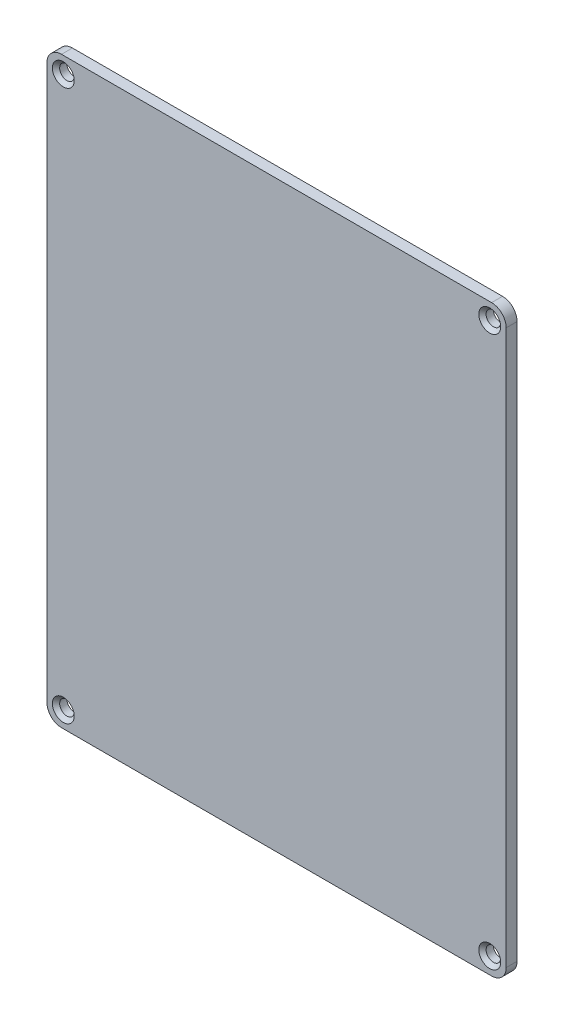
from build123d import *

# Parameters (mm, degrees)
IZIM1_W                     = 63
IZIM1_H                     = 80
Y_KSEKLIK_EKSTR_ZYON1_DEPTH = 1.5
IZIM2_R                     = 1
KES_EKSTR_ZYON1_DEPTH       = 1.5
RADYUS1_R                   = 2
PAH1_SIZE                   = 0.5


with BuildPart() as part:
    # Çizim1 → Yükseklik-Ekstrüzyon1 (new body)
    with BuildSketch(Plane.XY):
        Rectangle(IZIM1_W, IZIM1_H)
    extrude(amount=Y_KSEKLIK_EKSTR_ZYON1_DEPTH)

    # Çizim2 → Kes-Ekstrüzyon1 (cut)
    with BuildSketch(Plane.XY.offset(1.5)):
        with Locations((-29.25, 37.75)):
            Circle(IZIM2_R)
        with Locations(Location((29.25, 37.75, 0), (0, 0, 180))):
            Circle(IZIM2_R)
        with Locations((29.25, -37.75)):
            Circle(IZIM2_R)
        with Locations(Location((-29.25, -37.75, 0), (0, 0, 180))):
            Circle(IZIM2_R)
    extrude(amount=-KES_EKSTR_ZYON1_DEPTH, mode=Mode.SUBTRACT)

    # Radyus1
    radyus1_edges = [part.edges().sort_by_distance(p)[0] for p in [
        (31.5, -40, 0.75),
        (-31.5, -40, 0.75),
        (-31.5, 40, 0.75),
        (31.5, 40, 0.75),
    ]]
    fillet(radyus1_edges, radius=RADYUS1_R)

    # Pah1
    pah1_edges = [part.edges().sort_by_distance(p)[0] for p in [
        (-28.25, -37.75, 1.5),
        (28.25, -37.75, 1.5),
        (30.25, 37.75, 1.5),
        (-30.25, 37.75, 1.5),
    ]]
    chamfer(pah1_edges, length=PAH1_SIZE)


solid = part.part
